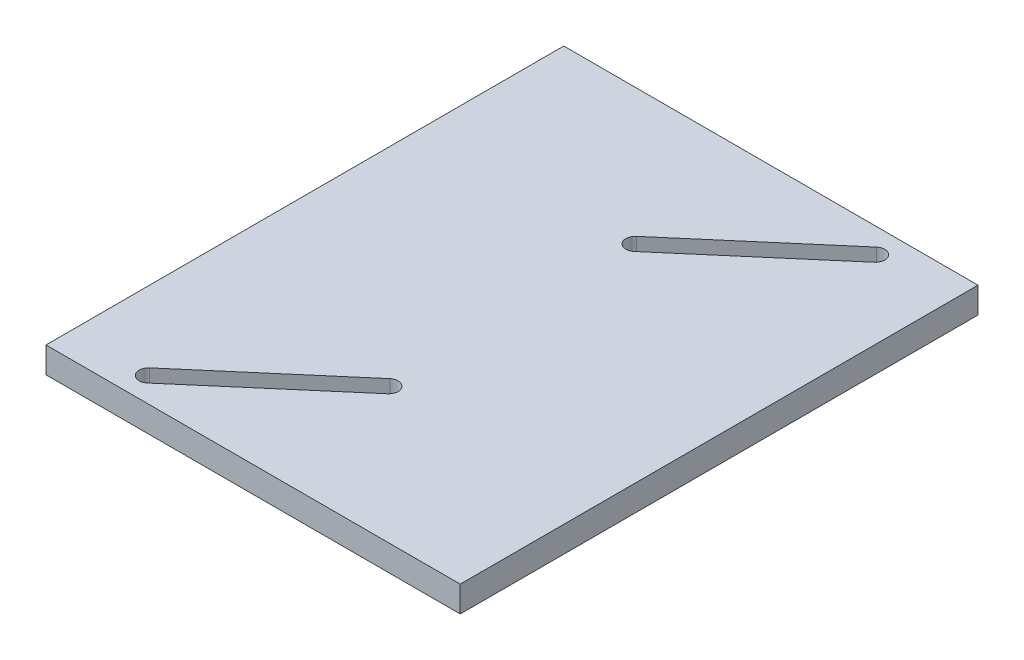
from build123d import *

# Parameters (mm, degrees)
SKETCH1_W           = 101.6
SKETCH1_H           = 127
BOSS_EXTRUDE1_DEPTH = 6.35
CUT_EXTRUDE1_DEPTH  = 82.567226875


with BuildPart() as part:
    # Sketch1 → Boss-Extrude1 (new body)
    with BuildSketch(Plane(origin=(0, 0, 0), x_dir=(1, 0, 0), z_dir=(0, 1, 0))):
        Rectangle(SKETCH1_W, SKETCH1_H)
    extrude(amount=BOSS_EXTRUDE1_DEPTH)

    # Sketch3 → Cut-Extrude1 (cut, through all)
    with BuildSketch(Plane(origin=(0, 6.35, 0), x_dir=(1, 0, 0), z_dir=(0, 1, 0))):
        with BuildLine():
            Line((-1.486564617, 31.962640907), (30.263435383, 59.140640907))
            ThreePointArc((30.263435383, 59.140640907), (33.486640907, 58.890564617), (33.236564617, 55.667359093))
            Line((33.236564617, 55.667359093), (1.486564617, 28.489359093))
            ThreePointArc((1.486564617, 28.489359093), (-1.736640907, 28.739435383), (-1.486564617, 31.962640907))
        make_face()
        with BuildLine():
            Line((1.486564617, -31.962640907), (-30.263435383, -59.140640907))
            ThreePointArc((-30.263435383, -59.140640907), (-33.486640907, -58.890564617), (-33.236564617, -55.667359093))
            Line((-33.236564617, -55.667359093), (-1.486564617, -28.489359093))
            ThreePointArc((-1.486564617, -28.489359093), (1.736640907, -28.739435383), (1.486564617, -31.962640907))
        make_face()
    extrude(amount=-CUT_EXTRUDE1_DEPTH, mode=Mode.SUBTRACT)


solid = part.part
